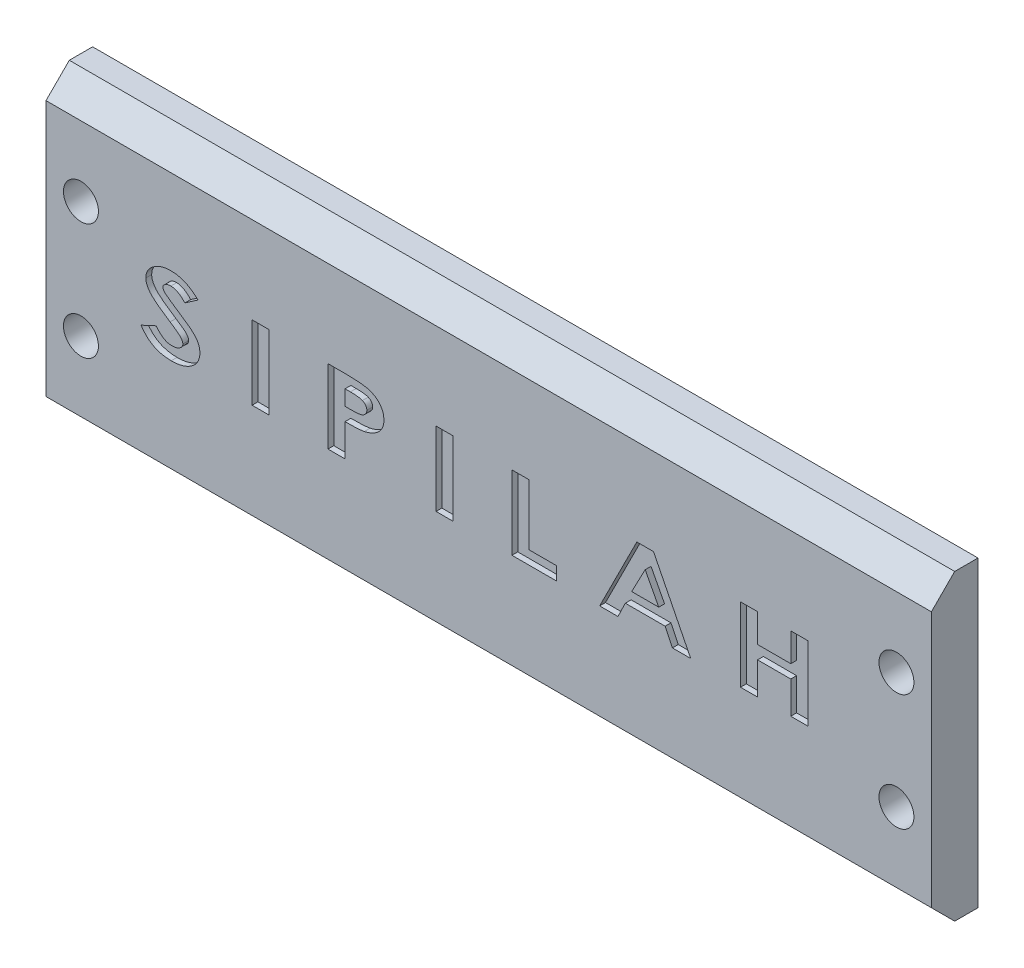
from build123d import *

# Parameters (mm, degrees)
SKETCH1_W           = 76
SKETCH1_H           = 26
BOSS_EXTRUDE1_DEPTH = 4
SKETCH2_W           = 1.465384615
SKETCH2_H           = 6.35
SKETCH2_W_2         = 1.465384616
CUT_EXTRUDE1_DEPTH  = 0.5
SKETCH3_R           = 1.5
CUT_EXTRUDE2_DEPTH  = 41.360872268
CHAMFER1_SIZE       = 2


with BuildPart() as part:
    # Sketch1 → Boss-Extrude1 (new body)
    with BuildSketch(Plane.XY):
        Rectangle(SKETCH1_W, SKETCH1_H)
    extrude(amount=BOSS_EXTRUDE1_DEPTH)

    # Sketch2 → Cut-Extrude1 (cut)
    # profile 1 of 7: a face of its own
    with BuildSketch(Plane.XY.offset(4)):
        with BuildLine():
            Line((-24.95224359, 2.701552484), (-26.077994792, 1.921794872))
            add(Edge.make_bspline(
                [(-26.077994792, 1.921794872), (-26.126867181, 1.97341703), (-26.22138768, 2.073255653), (-26.370858266, 2.20634683), (-26.521046103, 2.318801015), (-26.671834014, 2.411634336), (-26.824023206, 2.483787465), (-26.977326307, 2.534825994), (-27.13116572, 2.567093963), (-27.234124527, 2.571094199), (-27.28515625, 2.573076923)],
                knots=[0, 0, 0, 0, 1.207669291, 2.335664454, 3.396356464, 4.392421051, 5.340108823, 6.251573568, 7.133389213, 8, 8, 8, 8], degree=3))
            add(Edge.make_bspline(
                [(-27.28515625, 2.573076923), (-27.332752058, 2.57182179), (-27.424376519, 2.569405591), (-27.555222356, 2.545178216), (-27.672424146, 2.504477756), (-27.773875926, 2.44921673), (-27.855689488, 2.38371315), (-27.919072136, 2.314518451), (-27.95755553, 2.23737225), (-27.96217815, 2.183354535), (-27.964423077, 2.157121394)],
                knots=[0, 0, 0, 0, 1.308994644, 2.519884291, 3.645670017, 4.711226319, 5.682704006, 6.518200215, 7.28037937, 8, 8, 8, 8], degree=3))
            add(Edge.make_bspline(
                [(-27.964423077, 2.157121394), (-27.962566476, 2.130639589), (-27.958799681, 2.076911536), (-27.931897703, 1.997948602), (-27.887799034, 1.921809256), (-27.847837747, 1.876619935), (-27.827043269, 1.853104968)],
                knots=[0, 0, 0, 0, 0.929301116, 1.885428076, 2.899649557, 4, 4, 4, 4], degree=3))
            add(Edge.make_bspline(
                [(-27.827043269, 1.853104968), (-27.807771416, 1.834608672), (-27.763067373, 1.791703655), (-27.679891404, 1.725371126), (-27.576296565, 1.641508269), (-27.445918849, 1.548134283), (-27.29496407, 1.437406064), (-27.118384803, 1.316492938), (-26.920760949, 1.178163963), (-26.779498307, 1.083673671), (-26.705108173, 1.033914263)],
                knots=[0, 0, 0, 0, 0.460866546, 1.069051162, 1.834896047, 2.761527, 3.83612926, 5.066510405, 6.455198905, 8, 8, 8, 8], degree=3))
            add(Edge.make_bspline(
                [(-26.705108173, 1.033914263), (-26.635524934, 0.987765091), (-26.503806556, 0.900406494), (-26.317308494, 0.775217166), (-26.152538873, 0.663450768), (-26.008280631, 0.565827462), (-25.886574596, 0.480426572), (-25.7855597, 0.409491191), (-25.70675751, 0.351261014), (-25.661979322, 0.316140303), (-25.642958734, 0.301221955)],
                knots=[0, 0, 0, 0, 1.552684983, 2.939172589, 4.176976497, 5.255162841, 6.178235249, 6.941768944, 7.550491478, 8, 8, 8, 8], degree=3))
            add(Edge.make_bspline(
                [(-25.642958734, 0.301221955), (-25.570344293, 0.240816638), (-25.432013114, 0.125743952), (-25.249732835, -0.054930976), (-25.099554134, -0.230957946), (-24.98233603, -0.406237767), (-24.895547209, -0.584106691), (-24.832945907, -0.767157807), (-24.797343182, -0.958831659), (-24.792078678, -1.089396777), (-24.789423077, -1.155258413)],
                knots=[0, 0, 0, 0, 1.292881224, 2.462950635, 3.509647133, 4.456510364, 5.341962874, 6.212247473, 7.098194766, 8, 8, 8, 8], degree=3))
            add(Edge.make_bspline(
                [(-24.789423077, -1.155258413), (-24.791056919, -1.21944726), (-24.794271839, -1.345751978), (-24.8293698, -1.530477717), (-24.882196401, -1.706575155), (-24.956751959, -1.874588775), (-25.054948919, -2.032426863), (-25.171907402, -2.183677053), (-25.312811617, -2.323959175), (-25.47198288, -2.455280217), (-25.648708751, -2.574609768), (-25.839867026, -2.679070898), (-26.044014685, -2.766706571), (-26.261106565, -2.838409247), (-26.490984657, -2.893566327), (-26.733597446, -2.934410724), (-26.989109718, -2.958978479), (-27.163833685, -2.961518901), (-27.253355369, -2.962820513)],
                knots=[0, 0, 0, 0, 0.902957558, 1.77675416, 2.638138365, 3.488188074, 4.356663338, 5.250152695, 6.174883614, 7.150484739, 8.152501359, 9.173326986, 10.213821441, 11.276962312, 12.389277065, 13.539836655, 14.739509126, 16, 16, 16, 16], degree=3))
            add(Edge.make_bspline(
                [(-27.253355369, -2.962820513), (-27.323769941, -2.961880639), (-27.462224845, -2.960032581), (-27.666463255, -2.94433094), (-27.86393404, -2.919091709), (-28.054706005, -2.883708665), (-28.238610853, -2.837718922), (-28.415497694, -2.782051022), (-28.585357334, -2.715478258), (-28.748892533, -2.639252076), (-28.905775071, -2.551212484), (-29.056376407, -2.451316199), (-29.201563579, -2.34072815), (-29.340934634, -2.217829504), (-29.473868231, -2.083084604), (-29.60186683, -1.937110731), (-29.724191138, -1.779760121), (-29.79896333, -1.667527948), (-29.836858974, -1.610647035)],
                knots=[0, 0, 0, 0, 1.105273542, 2.173279444, 3.213565855, 4.229263474, 5.217276341, 6.187756421, 7.138309119, 8.079281442, 9.018038101, 9.95957529, 10.914128178, 11.880948991, 12.874083274, 13.883479761, 14.927316466, 16, 16, 16, 16], degree=3))
            Line((-29.836858974, -1.610647035), (-28.539383013, -1.008974359))
            add(Edge.make_bspline(
                [(-28.539383013, -1.008974359), (-28.491010797, -1.073600316), (-28.397305842, -1.198791447), (-28.241040841, -1.363808494), (-28.081699227, -1.50663067), (-27.914469175, -1.621017108), (-27.742462695, -1.71219442), (-27.564280967, -1.775849794), (-27.380640472, -1.815881804), (-27.256100178, -1.820671875), (-27.193569712, -1.823076923)],
                knots=[0, 0, 0, 0, 1.183126636, 2.291911316, 3.327479545, 4.315960281, 5.256209658, 6.174923512, 7.083646907, 8, 8, 8, 8], degree=3))
            add(Edge.make_bspline(
                [(-27.193569712, -1.823076923), (-27.129784204, -1.821082303), (-27.006310739, -1.817221195), (-26.829593521, -1.781796581), (-26.667565562, -1.72691452), (-26.527154881, -1.646483294), (-26.408560466, -1.554824455), (-26.320564642, -1.45212384), (-26.264080806, -1.339800325), (-26.25787628, -1.260582968), (-26.254807692, -1.221404247)],
                knots=[0, 0, 0, 0, 1.250982055, 2.421601618, 3.52480127, 4.59457637, 5.583980509, 6.452687854, 7.234742052, 8, 8, 8, 8], degree=3))
            add(Edge.make_bspline(
                [(-26.254807692, -1.221404247), (-26.257338923, -1.185029387), (-26.262536028, -1.110344786), (-26.304313331, -1.000541378), (-26.36775234, -0.890717209), (-26.442325385, -0.801591107), (-26.518982597, -0.72778578), (-26.591929629, -0.66229998), (-26.680877247, -0.590455644), (-26.785655263, -0.511706711), (-26.905212825, -0.425751151), (-27.038766652, -0.3307683), (-27.189253924, -0.230996173), (-27.294861113, -0.162148004), (-27.350030048, -0.126181891)],
                knots=[0, 0, 0, 0, 0.815327801, 1.67402515, 2.608680218, 3.657665297, 4.270694342, 4.999323204, 5.859287847, 6.838608332, 7.943834011, 9.167558269, 10.52033944, 12, 12, 12, 12], degree=3))
            add(Edge.make_bspline(
                [(-27.350030048, -0.126181891), (-27.454974796, -0.057816412), (-27.656094777, 0.073201712), (-27.941471538, 0.266444285), (-28.197450872, 0.448076946), (-28.42397122, 0.618185567), (-28.621418859, 0.776240675), (-28.791654643, 0.919851644), (-28.930704484, 1.053933077), (-29.045089582, 1.176863591), (-29.136561428, 1.295461965), (-29.215840758, 1.41016909), (-29.279662684, 1.526574537), (-29.336040954, 1.641136329), (-29.377768119, 1.756843188), (-29.407167675, 1.872324498), (-29.425828411, 1.987337499), (-29.428485877, 2.064195148), (-29.429807692, 2.102423878)],
                knots=[0, 0, 0, 0, 1.89919295, 3.639683364, 5.225705325, 6.658205857, 7.934446372, 9.060714954, 10.033806128, 10.862042785, 11.604144816, 12.303191233, 12.973898893, 13.615209792, 14.237579864, 14.834833964, 15.420450427, 16, 16, 16, 16], degree=3))
            add(Edge.make_bspline(
                [(-29.429807692, 2.102423878), (-29.427844302, 2.156842851), (-29.423965253, 2.264357839), (-29.393195432, 2.422335649), (-29.345699514, 2.575286622), (-29.273978466, 2.720379013), (-29.185624745, 2.860852535), (-29.076558092, 2.994293272), (-28.948432358, 3.122305492), (-28.801588991, 3.241435988), (-28.641069186, 3.351693254), (-28.469196141, 3.448579127), (-28.287541959, 3.529882371), (-28.097590514, 3.597751793), (-27.89836914, 3.649797891), (-27.689947326, 3.686611404), (-27.472181916, 3.708269124), (-27.323790034, 3.711285403), (-27.248267228, 3.712820513)],
                knots=[0, 0, 0, 0, 0.869527605, 1.71791649, 2.564868322, 3.423034978, 4.29767548, 5.213596993, 6.172427456, 7.188991251, 8.232708049, 9.283076077, 10.339096273, 11.411315699, 12.504907975, 13.627395035, 14.792482552, 16, 16, 16, 16], degree=3))
            add(Edge.make_bspline(
                [(-27.248267228, 3.712820513), (-27.150176117, 3.710098782), (-26.955689499, 3.704702368), (-26.668170917, 3.662489609), (-26.387692362, 3.595274099), (-26.159665262, 3.515111978), (-25.978458415, 3.435954152), (-25.839623114, 3.364419519), (-25.698649703, 3.280755392), (-25.553008787, 3.1889468), (-25.407372987, 3.081793697), (-25.256858193, 2.96657005), (-25.104144912, 2.839187678), (-25.003651959, 2.748132729), (-24.95224359, 2.701552484)],
                knots=[0, 0, 0, 0, 1.370666987, 2.717640612, 4.053103165, 5.397100452, 6.08976297, 6.816069123, 7.578454649, 8.38077928, 9.221355996, 10.104544732, 11.030357245, 12, 12, 12, 12], degree=3))
        make_face()
    # profile 2 of 7: a face of its own
    with BuildSketch(Plane.XY.offset(4)):
        with Locations((-19.579166667, 0.375)):
            Rectangle(SKETCH2_W, SKETCH2_H)
    # profile 3 of 7: a face of its own
    with BuildSketch(Plane.XY.offset(4)):
        with BuildLine():
            Line((-13.799038462, 3.55), (-12.167017228, 3.55))
            add(Edge.make_bspline(
                [(-12.167017228, 3.55), (-12.060584758, 3.549631943), (-11.855310986, 3.548922081), (-11.558819967, 3.540157921), (-11.285294102, 3.524685117), (-11.034880368, 3.505363393), (-10.8075607, 3.478231859), (-10.603169358, 3.447561327), (-10.421678943, 3.409819142), (-10.261084796, 3.364880262), (-10.116322141, 3.312496969), (-9.980329375, 3.256156562), (-9.853965396, 3.188937456), (-9.732821923, 3.118416329), (-9.621449282, 3.03805414), (-9.517513824, 2.950667938), (-9.42056936, 2.857042018), (-9.332899173, 2.754952012), (-9.254415336, 2.64721271), (-9.184655835, 2.534496466), (-9.126423274, 2.415893889), (-9.07765743, 2.292295879), (-9.040530899, 2.163221803), (-9.015985218, 2.02849715), (-8.998252545, 1.889189466), (-8.996645255, 1.794225167), (-8.995833333, 1.746254006)],
                knots=[0, 0, 0, 0, 1.855107689, 3.577902052, 5.169361155, 6.630109933, 7.954766161, 9.158917748, 10.231552938, 11.183798028, 12.062755255, 12.913834021, 13.746847176, 14.555505333, 15.355368483, 16.136995589, 16.920960237, 17.701748312, 18.479311714, 19.242374405, 20.009185935, 20.77912529, 21.55573978, 22.345708185, 23.164335441, 24, 24, 24, 24], degree=3))
            add(Edge.make_bspline(
                [(-8.995833333, 1.746254006), (-8.99749565, 1.693198443), (-9.000766063, 1.588817886), (-9.020716206, 1.435597445), (-9.056866566, 1.28953302), (-9.106610469, 1.150103813), (-9.170308997, 1.017353961), (-9.248645458, 0.891412053), (-9.341859817, 0.773464926), (-9.448267949, 0.662284791), (-9.566080852, 0.558944999), (-9.693973767, 0.462403987), (-9.833380055, 0.376369282), (-9.982277858, 0.297708712), (-10.14100244, 0.225896604), (-10.309758988, 0.162886953), (-10.488837843, 0.107292853), (-10.612798668, 0.079061061), (-10.676191907, 0.064623397)],
                knots=[0, 0, 0, 0, 0.983245981, 1.934420402, 2.856730671, 3.766303004, 4.672952299, 5.579907935, 6.508820747, 7.45354822, 8.427711485, 9.40982672, 10.419219512, 11.459572099, 12.528575546, 13.644949869, 14.795633565, 16, 16, 16, 16], degree=3))
            add(Edge.make_bspline(
                [(-10.676191907, 0.064623397), (-10.718092805, 0.056516219), (-10.809112961, 0.038905222), (-10.958358654, 0.021262706), (-11.130534371, 0.004686166), (-11.326050849, -0.009276357), (-11.544932508, -0.018823422), (-11.787062473, -0.026353124), (-12.05251014, -0.031753514), (-12.237400253, -0.031949337), (-12.333653846, -0.032051282)],
                knots=[0, 0, 0, 0, 0.615940763, 1.337991025, 2.168184893, 3.113261968, 4.167258378, 5.33087916, 6.610458565, 8, 8, 8, 8], degree=3))
            Line((-12.333653846, -0.032051282), (-12.333653846, -2.8))
            Line((-12.333653846, -2.8), (-13.799038462, -2.8))
            Line((-13.799038462, -2.8), (-13.799038462, 3.55))
        make_face()
        with BuildLine():
            Line((-12.333653846, 1.107692308), (-11.817207532, 1.107692308))
            add(Edge.make_bspline(
                [(-11.817207532, 1.107692308), (-11.768445317, 1.108036154), (-11.674730761, 1.108696981), (-11.539866704, 1.110926538), (-11.416838763, 1.115685062), (-11.305370838, 1.123869455), (-11.205540661, 1.13179), (-11.117014912, 1.143930102), (-11.039905896, 1.155534554), (-10.953984982, 1.175967928), (-10.859942869, 1.207239458), (-10.75918234, 1.25625591), (-10.670529903, 1.314301237), (-10.595735876, 1.383943391), (-10.535100388, 1.4625379), (-10.492729976, 1.551026139), (-10.466231373, 1.64678822), (-10.462914802, 1.713430115), (-10.461217949, 1.747526042)],
                knots=[0, 0, 0, 0, 1.392285696, 2.675789788, 3.851106149, 4.906862521, 5.867013269, 6.709429052, 7.457775361, 8.092061581, 9.229094434, 10.279492485, 11.283446023, 12.242833232, 13.184721612, 14.099774538, 15.027789537, 16, 16, 16, 16], degree=3))
            add(Edge.make_bspline(
                [(-10.461217949, 1.747526042), (-10.462456918, 1.77730163), (-10.46486975, 1.835288155), (-10.483155124, 1.918952894), (-10.512710997, 1.996802505), (-10.554678799, 2.068727103), (-10.610683904, 2.132346735), (-10.676853454, 2.19052392), (-10.754577546, 2.243387603), (-10.813530985, 2.270345985), (-10.844100561, 2.28432492)],
                knots=[0, 0, 0, 0, 1.01607562, 1.978758329, 2.909106172, 3.850207249, 4.805018697, 5.789768104, 6.853911621, 8, 8, 8, 8], degree=3))
            add(Edge.make_bspline(
                [(-10.844100561, 2.28432492), (-10.869798474, 2.294564235), (-10.924952544, 2.316540335), (-11.017606701, 2.341124146), (-11.124266513, 2.362394673), (-11.245722093, 2.380008185), (-11.381964687, 2.393604962), (-11.533397786, 2.40401735), (-11.699734832, 2.408181914), (-11.81551112, 2.409546665), (-11.875721154, 2.41025641)],
                knots=[0, 0, 0, 0, 0.634816011, 1.362472005, 2.197016134, 3.132082461, 4.179500588, 5.340894497, 6.617118958, 8, 8, 8, 8], degree=3))
            Line((-11.875721154, 2.41025641), (-12.333653846, 2.41025641))
            Line((-12.333653846, 2.41025641), (-12.333653846, 1.107692308))
        make_face(mode=Mode.SUBTRACT)
    # profile 4 of 7: a face of its own
    with BuildSketch(Plane.XY.offset(4)):
        with Locations((-3.785576923, 0.375)):
            Rectangle(SKETCH2_W_2, SKETCH2_H)
    # profile 5 of 7: a face of its own
    with BuildSketch(Plane.XY.offset(4)):
        Polygon((1.994551282, 3.55), (3.459935897, 3.55), (3.459935897, -1.66025641), (5.820833333, -1.66025641), (5.820833333, -2.8), (1.994551282, -2.8), align=None)
    # profile 6 of 7: a face of its own
    with BuildSketch(Plane.XY.offset(4)):
        Polygon((12.715264423, 3.55), (14.146304087, 3.55), (17.340384615, -2.8), (15.769421074, -2.8), (15.142307692, -1.497435897), (11.724348958, -1.497435897), (11.097235577, -2.8), (9.525, -2.8), align=None)
        Polygon((13.432692308, 1.846744792), (12.272596154, -0.357692308), (14.595332532, -0.357692308), align=None, mode=Mode.SUBTRACT)
    # profile 7 of 7: a face of its own
    with BuildSketch(Plane.XY.offset(4)):
        Polygon((21.614423077, 3.55), (23.079807692, 3.55), (23.079807692, 1.107692308), (25.929166667, 1.107692308), (25.929166667, 3.55), (27.394551282, 3.55), (27.394551282, -2.8), (25.929166667, -2.8), (25.929166667, -0.032051282), (23.079807692, -0.032051282), (23.079807692, -2.8), (21.614423077, -2.8), align=None)
    extrude(amount=-CUT_EXTRUDE1_DEPTH, mode=Mode.SUBTRACT)

    # Sketch3 → Cut-Extrude2 (cut, through all)
    with BuildSketch(Plane.XY.offset(4)):
        with Locations((-35, 5)):
            Circle(SKETCH3_R)
        with Locations((-35, -5)):
            Circle(SKETCH3_R)
        with Locations(Location((35, -5, 0), (0, 0, 180))):
            Circle(SKETCH3_R)
        with Locations(Location((35, 5, 0), (0, 0, 180))):
            Circle(SKETCH3_R)
    extrude(amount=-CUT_EXTRUDE2_DEPTH, mode=Mode.SUBTRACT)

    # Chamfer1
    chamfer1_edges = [part.edges().sort_by_distance(p)[0] for p in [
        (0, -13, 4),
        (0, 13, 4),
    ]]
    chamfer(chamfer1_edges, length=CHAMFER1_SIZE)


solid = part.part
